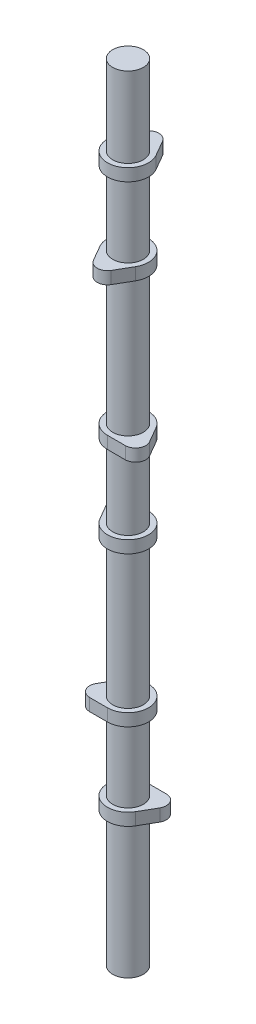
from build123d import *

# Parameters (mm, degrees)
BOSS_EXTRUDE1_DEPTH   = 7.62
LPATTERN2_COUNT       = 2
LPATTERN2_PITCH       = 53.34
BODY_MOVE_COPY1_ANGLE = 180
LPATTERN3_COUNT       = 3
LPATTERN3_PITCH       = 146.05
BODY_MOVE_COPY2_ANGLE = 120
BODY_MOVE_COPY3_ANGLE = 120
BOSS_EXTRUDE2_START   = 57.15
SKETCH2_R             = 9.5
BOSS_EXTRUDE2_DEPTH   = 486.09


with BuildPart() as part:
    # Sketch1 → Boss-Extrude1 (new body)
    with BuildSketch(Plane(origin=(0, 0, 0), x_dir=(1, 0, 0), z_dir=(0, 1, 0))):
        with BuildLine():
            Line((-5.499261314, 15.875), (-10.998522628, 6.35))
            ThreePointArc((-10.998522628, 6.35), (0, -12.7), (10.998522628, 6.35))
            Line((10.998522628, 6.35), (5.499261314, 15.875))
            ThreePointArc((5.499261314, 15.875), (0, 19.05), (-5.499261314, 15.875))
        make_face()
    extrude(amount=BOSS_EXTRUDE1_DEPTH)


with BuildPart() as lpattern2_1:
    # LPattern2: pattern copy
    add(part.part.moved(Location(Vector(0, -1, 0) * (1 * LPATTERN2_PITCH))))


with BuildPart() as lpattern2_1_1:
    # Body-Move/Copy1: moved
    add(lpattern2_1.part.rotate(Axis((0, 0, 0), (0, 1, 0)), BODY_MOVE_COPY1_ANGLE))


with BuildPart() as lpattern3_1:
    # LPattern3: pattern copy
    add(part.part.moved(Location(Vector(0, -1, 0) * (1 * LPATTERN3_PITCH))))


with BuildPart() as lpattern3_2:
    # LPattern3: pattern copy
    add(part.part.moved(Location(Vector(0, -1, 0) * (2 * LPATTERN3_PITCH))))


with BuildPart() as lpattern3_3:
    # LPattern3: pattern copy
    add(lpattern2_1_1.part.moved(Location(Vector(0, -1, 0) * (1 * LPATTERN3_PITCH))))


with BuildPart() as lpattern3_4:
    # LPattern3: pattern copy
    add(lpattern2_1_1.part.moved(Location(Vector(0, -1, 0) * (2 * LPATTERN3_PITCH))))


with BuildPart() as lpattern3_1_1:
    # Body-Move/Copy2: moved
    add(lpattern3_1.part.rotate(Axis((0, 0, 0), (0, -1, 0)), BODY_MOVE_COPY2_ANGLE))


with BuildPart() as lpattern3_3_1:
    # Body-Move/Copy2: moved
    add(lpattern3_3.part.rotate(Axis((0, 0, 0), (0, -1, 0)), BODY_MOVE_COPY2_ANGLE))


with BuildPart() as lpattern3_2_1:
    # Body-Move/Copy3: moved
    add(lpattern3_2.part.rotate(Axis((0, 0, 0), (0, 1, 0)), BODY_MOVE_COPY3_ANGLE))


with BuildPart() as lpattern3_4_1:
    # Body-Move/Copy3: moved
    add(lpattern3_4.part.rotate(Axis((0, 0, 0), (0, 1, 0)), BODY_MOVE_COPY3_ANGLE))


with BuildPart() as part_1:
    add(part.part)

    add(lpattern2_1_1.part)  # Boss-Extrude2 merges LPattern2_1

    add(lpattern3_1_1.part)  # Boss-Extrude2 merges LPattern3_1

    add(lpattern3_2_1.part)  # Boss-Extrude2 merges LPattern3_2

    add(lpattern3_3_1.part)  # Boss-Extrude2 merges LPattern3_3

    add(lpattern3_4_1.part)  # Boss-Extrude2 merges LPattern3_4
    # Sketch2 → Boss-Extrude2 (add)
    with BuildSketch(Plane(origin=(0, 0, 0), x_dir=(1, 0, 0), z_dir=(0, 1, 0)).offset(BOSS_EXTRUDE2_START)):
        Circle(SKETCH2_R)
    extrude(amount=-BOSS_EXTRUDE2_DEPTH)


solid = part_1.part
